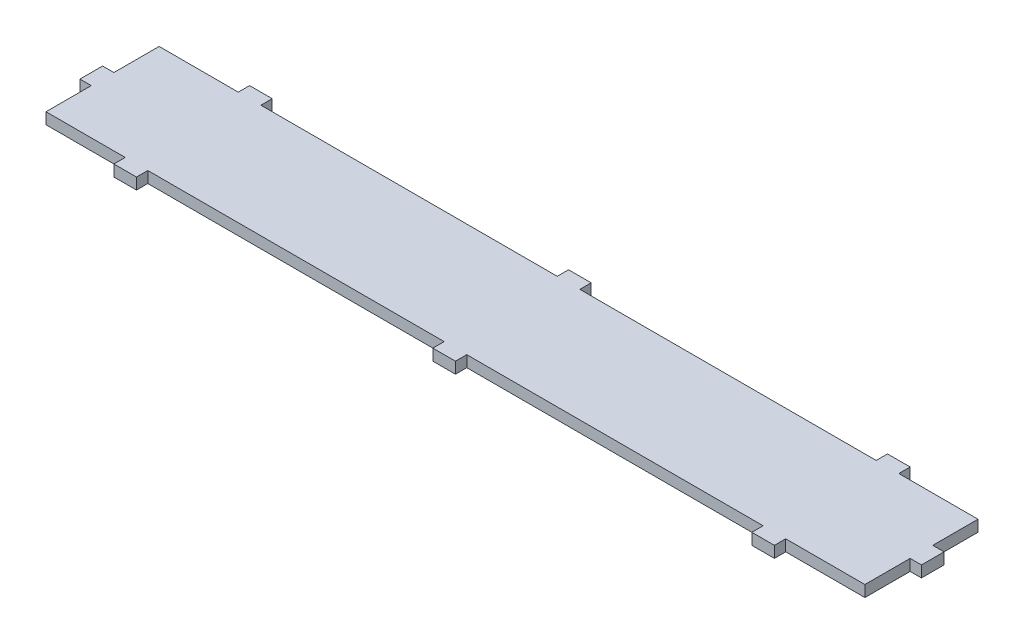
from build123d import *

# Parameters (mm, degrees)
BOSS_EXTRUDE1_DEPTH = 5


with BuildPart() as part:
    # Sketch1 → Boss-Extrude1 (new body)
    with BuildSketch(Plane(origin=(0, 0, 0), x_dir=(1, 0, 0), z_dir=(0, 1, 0))):
        Polygon((-181, 25), (-181, 5), (-186, 5), (-186, -5), (-181, -5), (-181, -25), (-146, -25), (-146, -30), (-136, -30), (-136, -25), (-5, -25), (-5, -30), (5, -30), (5, -25), (136, -25), (136, -30), (146, -30), (146, -25), (181, -25), (181, -5), (186, -5), (186, 5), (181, 5), (181, 25), (146, 25), (146, 30), (136, 30), (136, 25), (5, 25), (5, 30), (-5, 30), (-5, 25), (-136, 25), (-136, 30), (-146, 30), (-146, 25), align=None)
    extrude(amount=BOSS_EXTRUDE1_DEPTH)


solid = part.part
